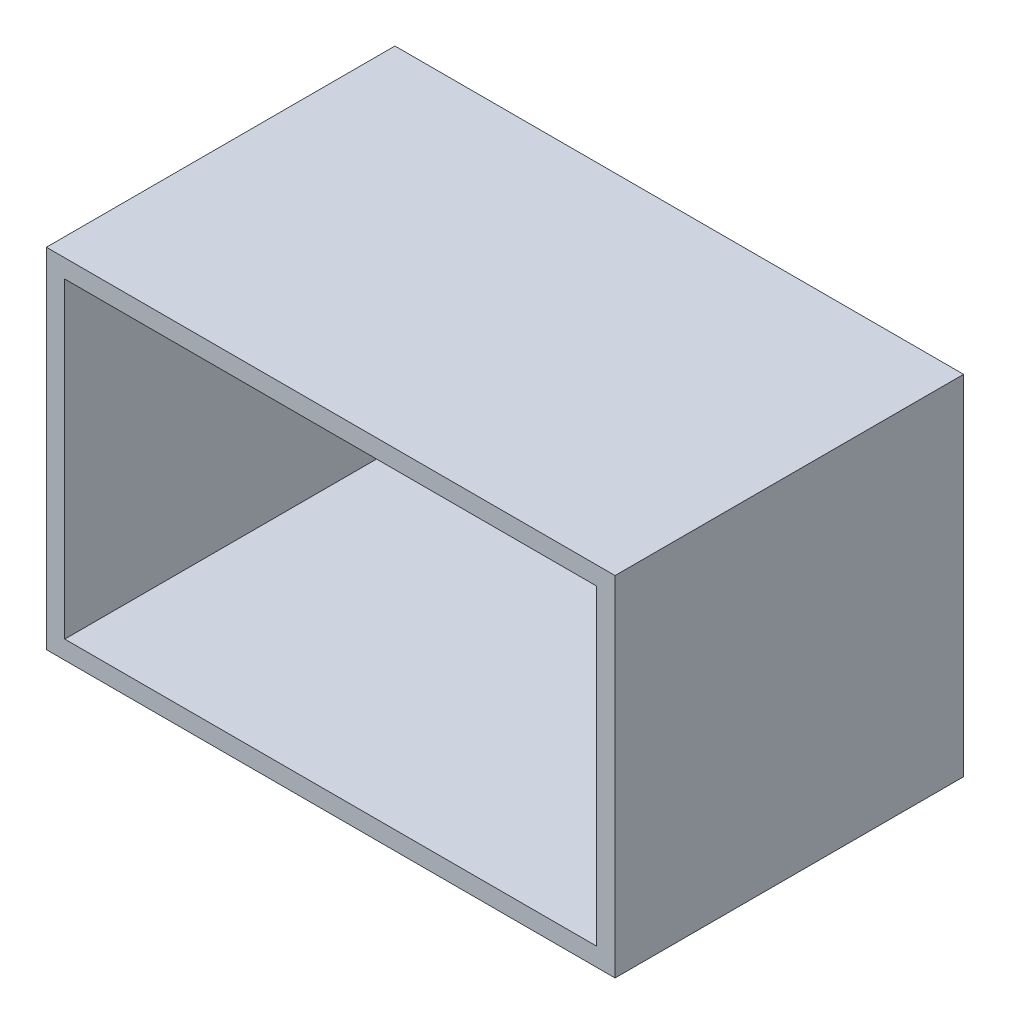
from build123d import *

# Parameters (mm, degrees)
SKETCH1_W           = 31
SKETCH1_H           = 19
BOSS_EXTRUDE1_DEPTH = 19
SHELL1_T            = -1


with BuildPart() as part:
    # Sketch1 → Boss-Extrude1 (new body)
    with BuildSketch(Plane.XY):
        Rectangle(SKETCH1_W, SKETCH1_H)
    extrude(amount=BOSS_EXTRUDE1_DEPTH)

    # Shell1
    shell1_openings = [part.faces().sort_by_distance(p)[0] for p in [
        (0, 0, 19),
    ]]
    offset(amount=SHELL1_T, openings=shell1_openings, kind=Kind.INTERSECTION)


solid = part.part
